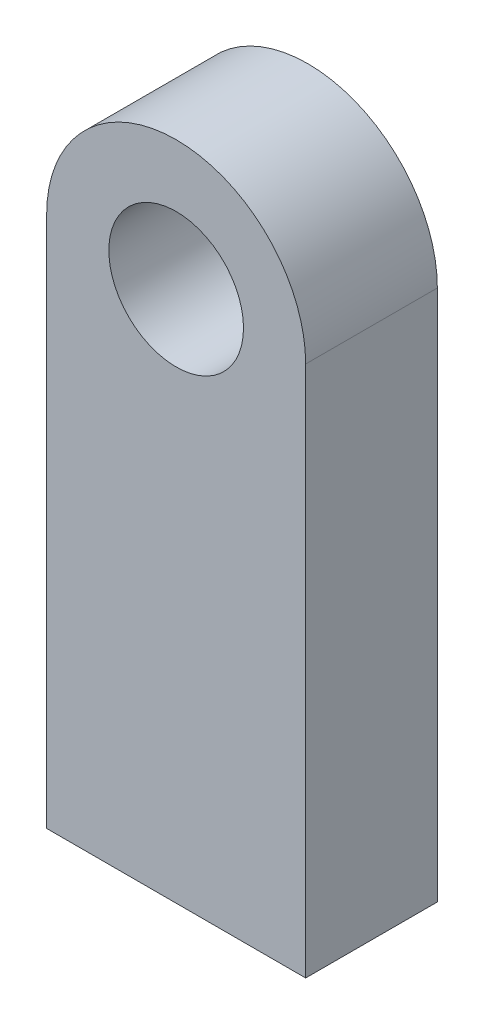
from build123d import *

# Parameters (mm, degrees)
BOSS_EXTRUDE1_DEPTH = 10
CUT_EXTRUDE1_REACH  = 56.851
SKETCH2_R           = 5.114059111


with BuildPart() as part:
    # Sketch1 → Boss-Extrude1 (new body)
    with BuildSketch(Plane.XY):
        with BuildLine():
            Line((0, 0), (-19.67027632, 0))
            Line((-19.67027632, 0), (-19.67027632, 40.381920209))
            ThreePointArc((-19.67027632, 40.381920209), (-9.83513816, 50.217058369), (0, 40.381920209))
            Line((0, 40.381920209), (0, 0))
        make_face()
    extrude(amount=BOSS_EXTRUDE1_DEPTH)

    # Sketch2 → Cut-Extrude1 (cut, up to next)
    with BuildSketch(Plane.XY.offset(10), mode=Mode.PRIVATE) as cut_extrude1_sk1:
        with Locations((-9.83513816, 40.381920209)):
            Circle(SKETCH2_R)
    cut_extrude1_tool1 = extrude(cut_extrude1_sk1.sketch, amount=-CUT_EXTRUDE1_REACH, mode=Mode.PRIVATE) & part.part
    add(cut_extrude1_tool1.solids().sort_by_distance((-9.835138, 40.38192, 10))[0], mode=Mode.SUBTRACT)


solid = part.part
